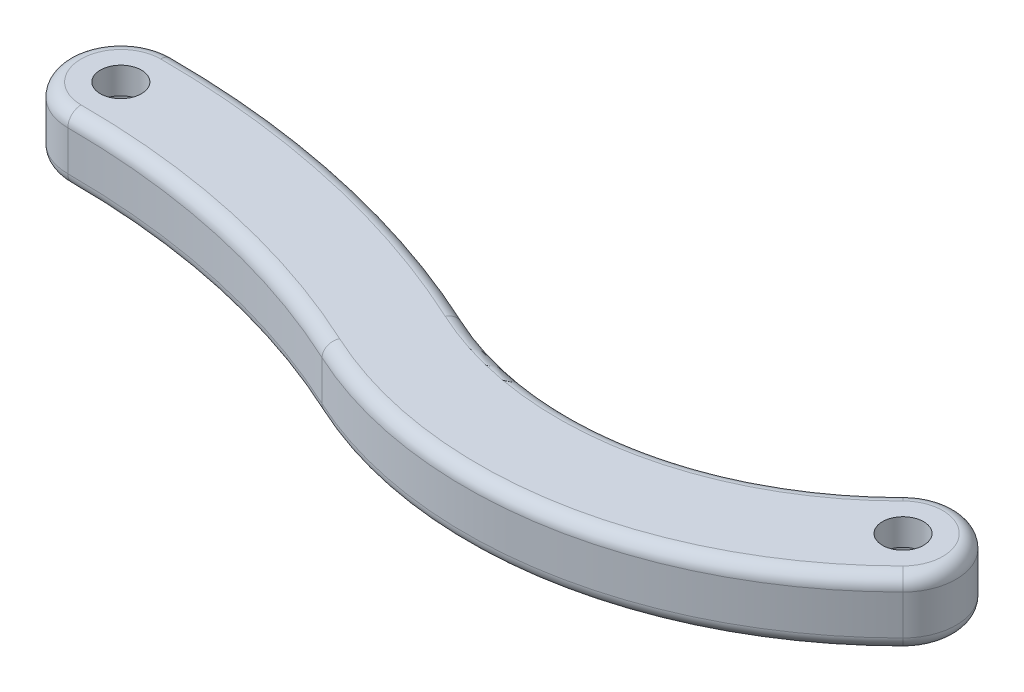
from build123d import *

# Parameters (mm, degrees)
SKETCH1_R           = 1.55
BOSS_EXTRUDE1_DEPTH = 5
FILLET1_R           = 1
SKETCH2_R           = 2.9
CUT_EXTRUDE1_DEPTH  = 3


with BuildPart() as part:
    # Sketch1 → Boss-Extrude1 (new body)
    with BuildSketch(Plane(origin=(0, 0, 0), x_dir=(1, 0, 0), z_dir=(0, 1, 0))):
        with BuildLine():
            ThreePointArc((-29.5, 4), (-33.5, 0), (-29.5, -4))
            ThreePointArc((-29.5, -4), (-16.900654795, -5.373538993), (-4.893229568, -9.429626812))
            ThreePointArc((-4.893229568, -9.429626812), (14.756477238, -11.986867848), (32.328427125, -2.828427125))
            ThreePointArc((32.328427125, -2.828427125), (32.328427125, 2.828427125), (26.671572875, 2.828427125))
            ThreePointArc((26.671572875, 2.828427125), (13.359489628, -4.109785544), (-1.526651892, -2.172481729))
            ThreePointArc((-1.526651892, -2.172481729), (-15.176874162, 2.438540137), (-29.5, 4))
        make_face()
        with Locations(Location((-29.5, 0, 0), (0, 0, 270))):
            Circle(SKETCH1_R, mode=Mode.SUBTRACT)
        with Locations(Location((29.5, 0, 0), (0, 0, 270))):
            Circle(SKETCH1_R, mode=Mode.SUBTRACT)
    extrude(amount=BOSS_EXTRUDE1_DEPTH)

    # Fillet1
    fillet1_edges = [part.edges().sort_by_distance(p)[0] for p in [
        (-16.900654795, 5, 5.373538993),
        (14.756477238, 5, 11.986867848),
        (32.328427125, 5, -2.828427125),
        (13.359489628, 5, 4.109785544),
        (-15.176874162, 5, -2.438540137),
        (13.359489628, 0, 4.109785544),
        (32.328427125, 0, -2.828427125),
        (14.756477238, 0, 11.986867848),
        (-16.900654795, 0, 5.373538993),
        (-33.5, 0, 0),
        (-15.176874162, 0, -2.438540137),
        (-33.5, 5, 0),
    ]]
    fillet(fillet1_edges, radius=FILLET1_R)

    # Sketch2 → Cut-Extrude1 (cut)
    with BuildSketch(Plane.XZ):
        with Locations(Location((29.5, 0, 0), (0, 0, 270))):
            Circle(SKETCH2_R)
        with Locations(Location((-29.5, 0, 0), (0, 0, 270))):
            Circle(SKETCH2_R)
    extrude(amount=-CUT_EXTRUDE1_DEPTH, mode=Mode.SUBTRACT)


solid = part.part
